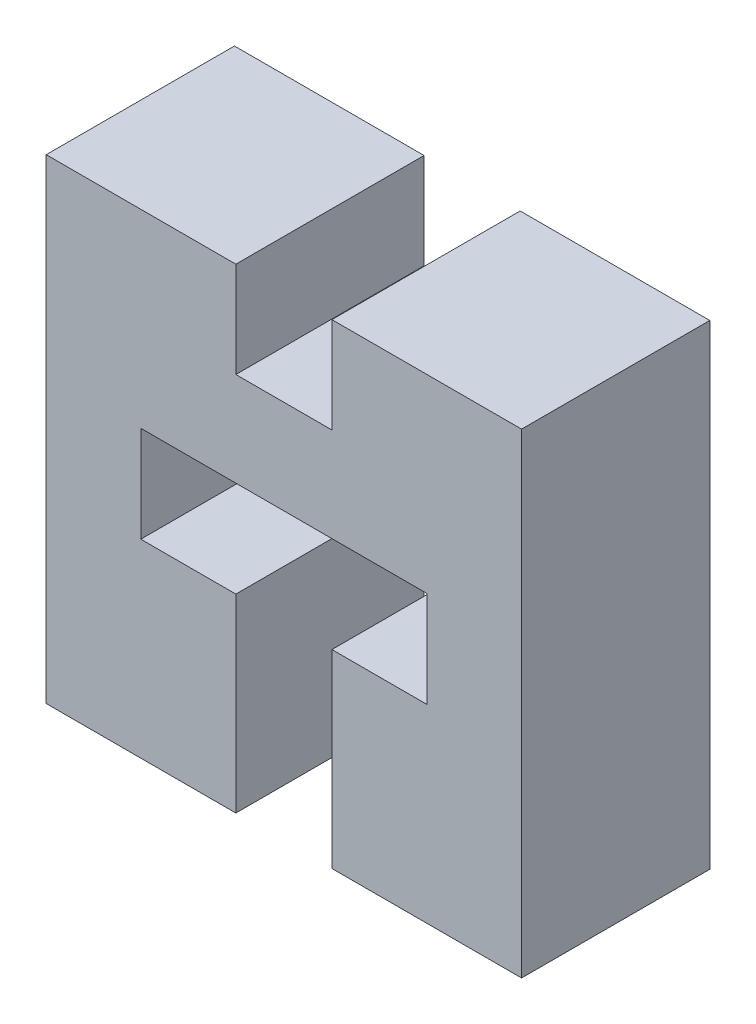
from build123d import *

# Parameters (mm, degrees)
BOSS_EXTRUDE1_DEPTH = 9.899999946


with BuildPart() as part:
    # Sketch1 → Boss-Extrude1 (new body)
    with BuildSketch(Plane.XY.offset(9.899999946)):
        Polygon((14.973999709, 9.973499775), (14.973999709, 15.026499293), (30.026500597, 15.026499293), (30.026500597, 9.973499775), (25.026499852, 9.973499775), (25.026499852, 0), (34.999999627, 0), (34.999999627, 25), (25.026499852, 25), (25.026499852, 19.974000454), (19.973499403, 19.974000454), (19.973499403, 25), (9.999999627, 25), (9.999999627, 0), (19.973499403, 0), (19.973499403, 9.973499775), align=None)
    extrude(amount=-BOSS_EXTRUDE1_DEPTH)


solid = part.part
